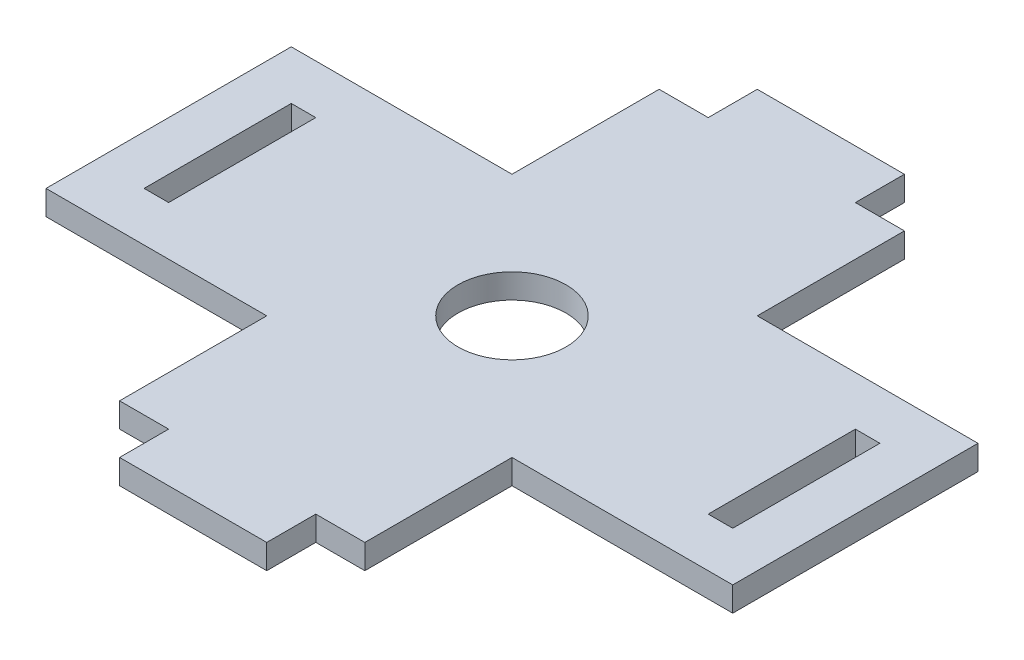
from build123d import *

# Parameters (mm, degrees)
BOSS_EXTRUDE2_DEPTH = 5
SKETCH2_W           = 5
SKETCH2_H           = 30
CUT_EXTRUDE4_DEPTH  = 100
SKETCH3_R           = 11
CUT_EXTRUDE5_DEPTH  = 100
SKETCH5_W           = 45
SKETCH5_H           = 30
CUT_EXTRUDE6_DEPTH  = 100


with BuildPart() as part:
    # Sketch1 → Boss-Extrude2 (new body)
    with BuildSketch(Plane(origin=(0, 0, 0), x_dir=(1, 0, 0), z_dir=(0, 1, 0))):
        Polygon((70, -55), (15, -55), (15, -65), (-15, -65), (-15, -55), (-70, -55), (-70, 55), (-15, 55), (-15, 65), (15, 65), (15, 55), (70, 55), align=None)
    extrude(amount=BOSS_EXTRUDE2_DEPTH)

    # Sketch2 → Cut-Extrude4 (cut)
    with BuildSketch(Plane(origin=(0, 5, 0), x_dir=(1, 0, 0), z_dir=(0, 1, 0))):
        with Locations((-57.5, 0)):
            Rectangle(SKETCH2_W, SKETCH2_H)
        with Locations((57.5, 0)):
            Rectangle(SKETCH2_W, SKETCH2_H)
    extrude(amount=-CUT_EXTRUDE4_DEPTH, mode=Mode.SUBTRACT)

    # Sketch3 → Cut-Extrude5 (cut)
    with BuildSketch(Plane(origin=(0, 0, 0), x_dir=(-1, 0, 0), z_dir=(0, -1, 0))):
        with Locations(Location((0, 0, 0), (0, 0, 90))):
            Circle(SKETCH3_R)
    extrude(amount=-CUT_EXTRUDE5_DEPTH, mode=Mode.SUBTRACT)

    # Sketch5 → Cut-Extrude6 (cut)
    with BuildSketch(Plane(origin=(0, 0, 0), x_dir=(-1, 0, 0), z_dir=(0, -1, 0))):
        with Locations((47.5, -40)):
            Rectangle(SKETCH5_W, SKETCH5_H)
        with Locations((47.5, 40)):
            Rectangle(SKETCH5_W, SKETCH5_H)
        with Locations((-47.5, 40)):
            Rectangle(SKETCH5_W, SKETCH5_H)
        with Locations((-47.5, -40)):
            Rectangle(SKETCH5_W, SKETCH5_H)
    extrude(amount=-CUT_EXTRUDE6_DEPTH, mode=Mode.SUBTRACT)


solid = part.part
